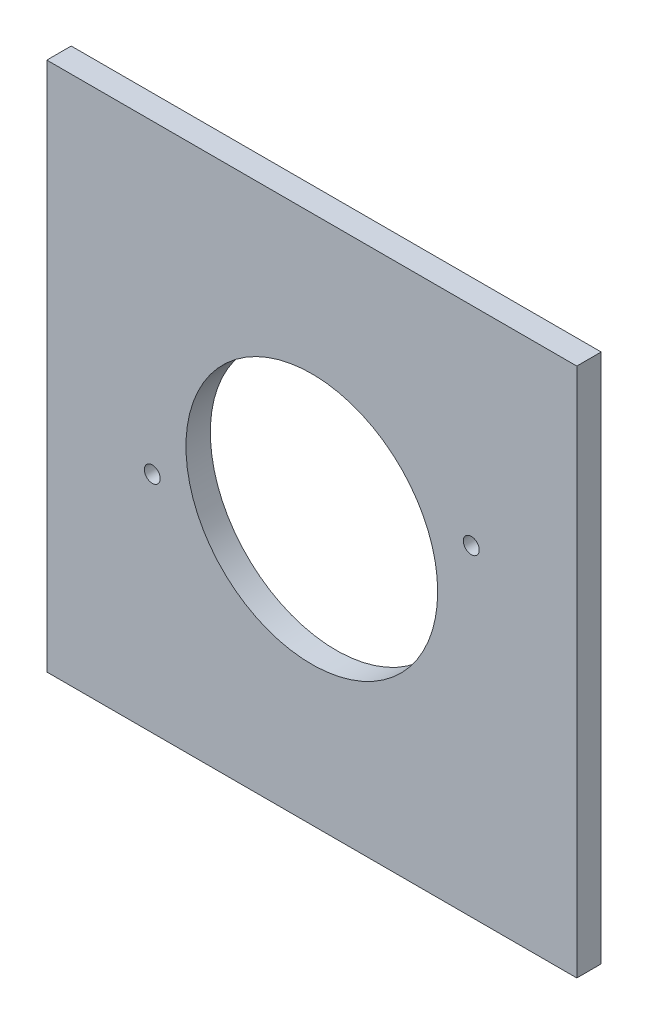
from build123d import *

# Parameters (mm, degrees)
ESQUISSE1_W             = 100
ESQUISSE1_H             = 100
ESQUISSE1_R             = 23.75
BOSS_EXTRU_1_DEPTH      = 4.6
ESQUISSE2_R             = 1.5
ENL_V_MAT_EXTRU_1_DEPTH = 10
ESQUISSE3_R             = 3
ENL_V_MAT_EXTRU_2_DEPTH = 2


with BuildPart() as part:
    # Esquisse1 → Boss.-Extru.1 (new body)
    with BuildSketch(Plane.XY):
        with Locations((5.828319543, -13.849884125)):
            Rectangle(ESQUISSE1_W, ESQUISSE1_H)
        with Locations((5.828319543, -13.849884125)):
            Circle(ESQUISSE1_R, mode=Mode.SUBTRACT)
    extrude(amount=BOSS_EXTRU_1_DEPTH)

    # Esquisse2 → Enlèv. mat.-Extru.1 (cut)
    with BuildSketch(Plane.XY.offset(4.6)):
        with Locations((-24.271680457, -21.559884125)):
            Circle(ESQUISSE2_R)
        with Locations((35.918319543, -3.129884125)):
            Circle(ESQUISSE2_R)
    extrude(amount=-ENL_V_MAT_EXTRU_1_DEPTH, mode=Mode.SUBTRACT)

    # Esquisse3 → Enlèv. mat.-Extru.2 (cut)
    with BuildSketch(Plane(origin=(0, 0, 0), x_dir=(-1, 0, 0), z_dir=(0, 0, -1))):
        with Locations((-35.918319543, -3.129884125)):
            Circle(ESQUISSE3_R)
        with Locations((24.271680457, -21.559884125)):
            Circle(ESQUISSE3_R)
    extrude(amount=-ENL_V_MAT_EXTRU_2_DEPTH, mode=Mode.SUBTRACT)


solid = part.part
